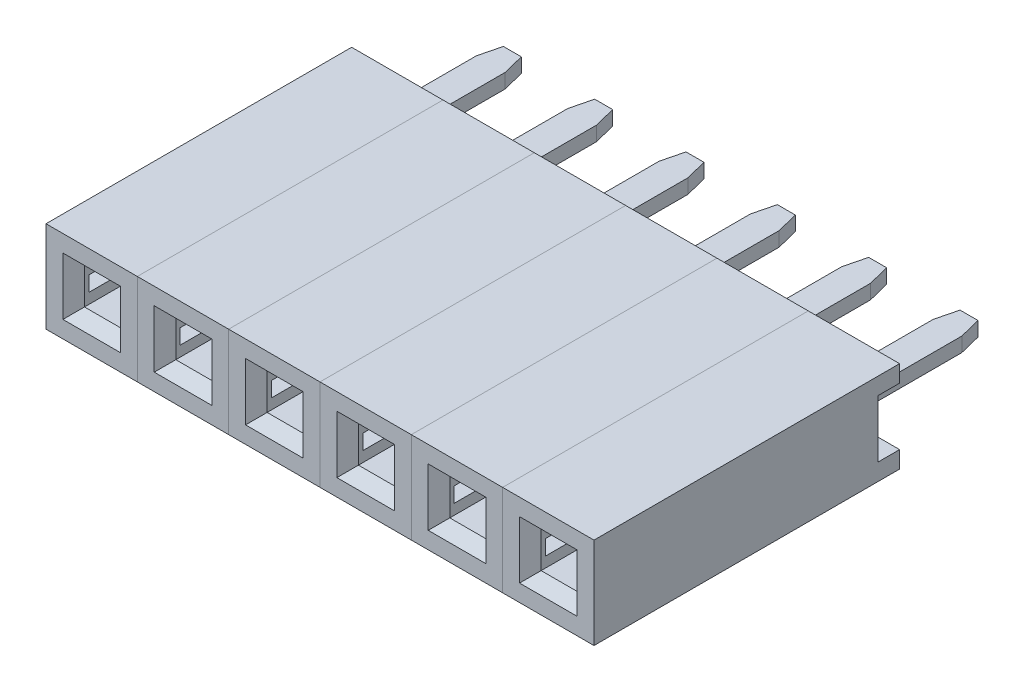
from build123d import *

# Parameters (mm, degrees)
SKETCH_1_W          = 2.54
SKETCH_1_H          = 2.54
EXTRUDE_1_DEPTH     = 8.5
SKETCH_2_W          = 2
SKETCH_2_H          = 0.42
CUT_EXTRUDE_1_DEPTH = 8.08
SKETCH_3_W          = 1
SKETCH_3_H          = 1
CUT_EXTRUDE_2_DEPTH = 6.5
SKETCH_4_W          = 0.6
SKETCH_4_H          = 1.6
CUT_EXTRUDE_3_DEPTH = 10.227849154
EXTRUDE_2_DEPTH     = 0.2
CHAMFER_1_SIZE      = 0.3
SKETCH1_W           = 0.8
SKETCH1_H           = 0.4
BOSS_EXTRUDE1_DEPTH = 3.2
CUT_EXTRUDE1_DEPTH  = 1
LPATTERN1_COUNT     = 6
LPATTERN1_PITCH     = 2.54


with BuildPart() as part:
    # Эскиз1 → Бобышка-Вытянуть1 (new body)
    with BuildSketch(Plane.XY):
        with Locations((0, 1.27)):
            Rectangle(SKETCH_1_W, SKETCH_1_H)
    extrude(amount=EXTRUDE_1_DEPTH)

    # Эскиз2 → Вырез-Вытянуть1 (cut)
    with BuildSketch(Plane(origin=(0, 0, 0), x_dir=(-1, 0, 0), z_dir=(0, 0, -1))):
        with Locations((0, 1.27)):
            Rectangle(SKETCH_2_W, SKETCH_2_H)
    extrude(amount=-CUT_EXTRUDE_1_DEPTH, mode=Mode.SUBTRACT)

    # Эскиз3 → Вырез-Вытянуть2 (cut)
    with BuildSketch(Plane.XY.offset(8.5)):
        with Locations((0, 1.27)):
            Rectangle(SKETCH_3_W, SKETCH_3_H)
    extrude(amount=-CUT_EXTRUDE_2_DEPTH, mode=Mode.SUBTRACT)

    # Эскиз4 → Вырез-Вытянуть3 (cut, through all)
    with BuildSketch(Plane.ZY.offset(1.27)):
        with Locations((0.3, 1.27)):
            Rectangle(SKETCH_4_W, SKETCH_4_H)
    extrude(amount=-CUT_EXTRUDE_3_DEPTH, mode=Mode.SUBTRACT)

    # Фаска1
    chamfer_1_edges = [part.edges().sort_by_distance(p)[0] for p in [
        (0.5, 1.27, 8.5),
        (0, 1.77, 8.5),
        (-0.5, 1.27, 8.5),
        (0, 0.77, 8.5),
    ]]
    chamfer(chamfer_1_edges, length=CHAMFER_1_SIZE)



with BuildPart() as body_2:
    # Эскиз6 → Бобышка-Вытянуть2 (new, symmetric)
    with BuildSketch(Plane(origin=(0, 1.27, 0), x_dir=(-1, 0, 0), z_dir=(0, -1, 0))):
        with BuildLine():
            Line((-0.4, 0), (0.4, 0))
            Line((0.4, 0), (0.4, -0.6))
            Line((0.4, -0.6), (0.6, -0.6))
            Line((0.6, -0.6), (1, -0.85))
            Line((1, -0.85), (1, -2.6))
            Line((1, -2.6), (0.813333333, -6.1))
            Line((0.813333333, -6.1), (0.45, -6.75))
            Line((0.45, -6.75), (0.3, -6.35))
            Line((0.3, -6.35), (0.5, -2.6))
            Line((0.5, -2.6), (0.5, -1.7))
            ThreePointArc((0.5, -1.7), (0, -1.2), (-0.5, -1.7))
            Line((-0.5, -1.7), (-0.5, -2.6))
            Line((-0.5, -2.6), (-0.3, -6.35))
            Line((-0.3, -6.35), (-0.45, -6.75))
            Line((-0.45, -6.75), (-0.813333333, -6.1))
            Line((-0.813333333, -6.1), (-1, -2.6))
            Line((-1, -2.6), (-1, -0.85))
            Line((-1, -0.85), (-0.6, -0.6))
            Line((-0.6, -0.6), (-0.4, -0.6))
            Line((-0.4, -0.6), (-0.4, 0))
        make_face()
    extrude(amount=EXTRUDE_2_DEPTH, both=True)


with BuildPart() as part_1:
    add(part.part)

    add(body_2.part)  # Boss-Extrude1 merges body 2
    # Sketch1 → Boss-Extrude1 (add)
    with BuildSketch(Plane(origin=(0, 0, 0), x_dir=(-1, 0, 0), z_dir=(0, 0, -1))):
        with Locations((0, 1.27)):
            Rectangle(SKETCH1_W, SKETCH1_H)
    extrude(amount=BOSS_EXTRUDE1_DEPTH)

    # Sketch2 → Cut-Extrude1 (cut)
    with BuildSketch(Plane(origin=(0, 1.47, 0), x_dir=(1, 0, 0), z_dir=(0, 1, 0))):
        Polygon((-0.4, 2.6), (-0.25, 3.2), (-0.4, 3.2), align=None)
        Polygon((0.4, 3.2), (0.25, 3.2), (0.4, 2.6), align=None)
        Polygon((0.25, 3.323331364), (0.25, 3.2), (0.4, 3.2), (0.4, 2.6), (0.533335502, 2.6), (0.533335502, 3.323331364), align=None)
        Polygon((-0.4, 3.2), (-0.25, 3.2), (-0.25, 3.209490078), (-0.25, 3.323331364), (-0.533335502, 3.323331364), (-0.533335502, 2.6), (-0.4, 2.6), align=None)
    extrude(amount=-CUT_EXTRUDE1_DEPTH, mode=Mode.SUBTRACT)


with BuildPart() as lpattern1_1:
    # LPattern1: pattern copy
    add(part_1.part.moved(Location(Vector(1, 0, 0) * (1 * LPATTERN1_PITCH))))


with BuildPart() as lpattern1_2:
    # LPattern1: pattern copy
    add(part_1.part.moved(Location(Vector(1, 0, 0) * (2 * LPATTERN1_PITCH))))


with BuildPart() as lpattern1_3:
    # LPattern1: pattern copy
    add(part_1.part.moved(Location(Vector(1, 0, 0) * (3 * LPATTERN1_PITCH))))


with BuildPart() as lpattern1_4:
    # LPattern1: pattern copy
    add(part_1.part.moved(Location(Vector(1, 0, 0) * (4 * LPATTERN1_PITCH))))


with BuildPart() as lpattern1_5:
    # LPattern1: pattern copy
    add(part_1.part.moved(Location(Vector(1, 0, 0) * (5 * LPATTERN1_PITCH))))


solid = Compound([part_1.part, lpattern1_1.part, lpattern1_2.part, lpattern1_3.part, lpattern1_4.part, lpattern1_5.part])
